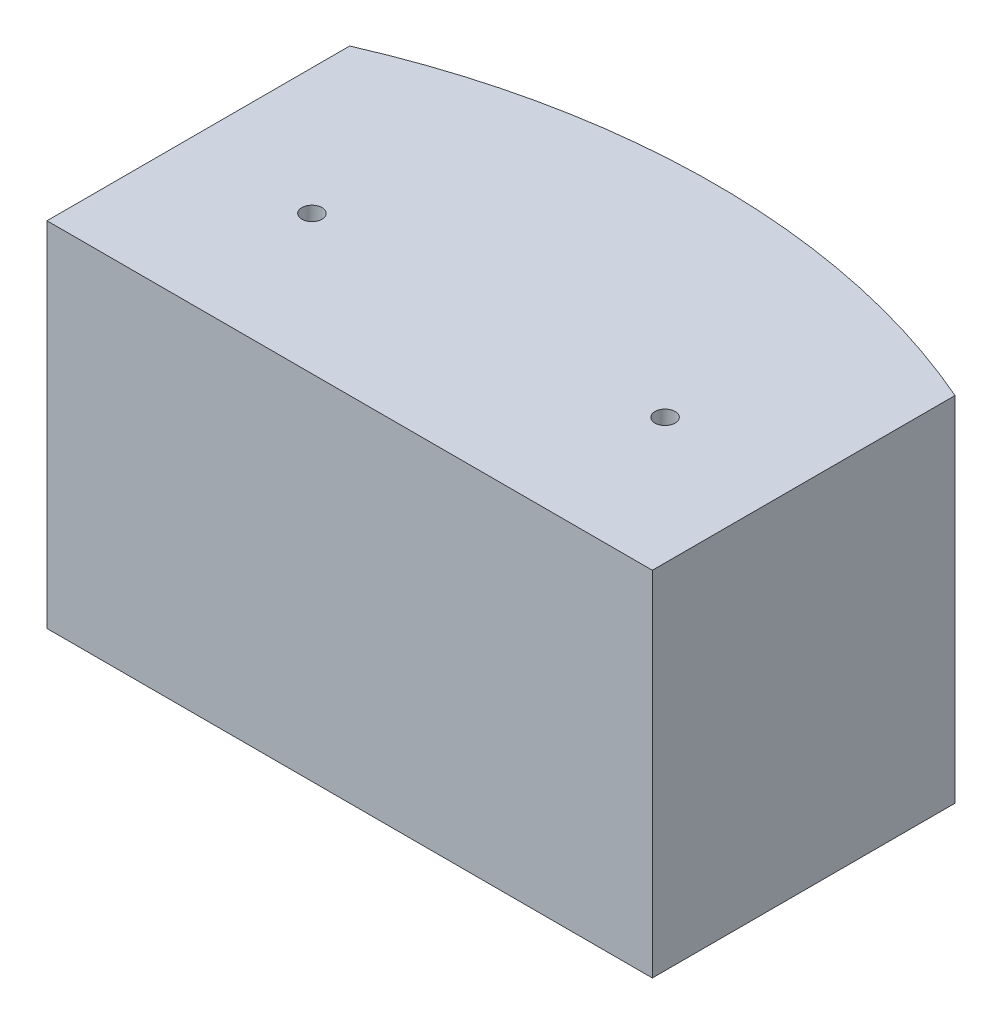
from build123d import *

# Parameters (mm, degrees)
BOSS_EXTRUDE1_DEPTH      = 70
SKETCH7_W                = 114
SKETCH7_H                = 64
CUT_EXTRUDE2_DEPTH       = 77
SKETCH8_W                = 3
SKETCH8_H                = 64
BOSS_EXTRUDE3_DEPTH      = 114
BOSS_EXTRUDE4_REACH      = 117.47
BOSS_EXTRUDE4_END_RADIUS = 150
SKETCH9_W                = 114
SKETCH9_H                = 3
SKETCH10_R               = 2
CUT_EXTRUDE3_DEPTH       = 3


with BuildPart() as part:
    # Sketch1 → Boss-Extrude1 (new body)
    with BuildSketch(Plane(origin=(0, 0, 0), x_dir=(1, 0, 0), z_dir=(0, 1, 0))):
        with BuildLine():
            Line((-60, 137.477270849), (-60, 77.477270849))
            Line((-60, 77.477270849), (60, 77.477270849))
            Line((60, 77.477270849), (60, 137.477270849))
            ThreePointArc((60, 137.477270849), (0, 150), (-60, 137.477270849))
        make_face()
    extrude(amount=BOSS_EXTRUDE1_DEPTH)

    # Sketch7 → Cut-Extrude2 (cut)
    with BuildSketch(Plane.XY.offset(-77.477270849)):
        with Locations((0, 35)):
            Rectangle(SKETCH7_W, SKETCH7_H)
    extrude(amount=-CUT_EXTRUDE2_DEPTH, mode=Mode.SUBTRACT)

    # Sketch8 → Boss-Extrude3 (add)
    with BuildSketch(Plane(origin=(-57, 0, 0), x_dir=(0, 0, -1), z_dir=(1, 0, 0))):
        with Locations((78.977270849, 35)):
            Rectangle(SKETCH8_W, SKETCH8_H)
    extrude(amount=BOSS_EXTRUDE3_DEPTH)

    # Boss-Extrude4: up to this cylinder (the profile starts inside it)
    boss_extrude4_end = Plane(origin=(0, 35, 0), z_dir=(0, -1, 0)) * Cylinder(BOSS_EXTRUDE4_END_RADIUS, 535.94, mode=Mode.PRIVATE)
    # Sketch9 → Boss-Extrude4 (add, up to the surface)
    with BuildSketch(Plane(origin=(0, 0, -80.477270849), x_dir=(-1, 0, 0), z_dir=(0, 0, -1)), mode=Mode.PRIVATE) as boss_extrude4_sk1:
        with Locations((0, 35)):
            Rectangle(SKETCH9_W, SKETCH9_H)
    boss_extrude4_tool1 = extrude(boss_extrude4_sk1.sketch, amount=BOSS_EXTRUDE4_REACH, mode=Mode.PRIVATE) & boss_extrude4_end
    add(boss_extrude4_tool1.solids().sort_by_distance((0, 35, -80.477271))[0])

    # Sketch10 → Cut-Extrude3 (cut)
    with BuildSketch(Plane(origin=(0, 70, 0), x_dir=(1, 0, 0), z_dir=(0, 1, 0))):
        with Locations(Location((-35, 104.997270849, 0), (0, 0, 270))):
            Circle(SKETCH10_R)
        with Locations(Location((35, 104.997270849, 0), (0, 0, 270))):
            Circle(SKETCH10_R)
    extrude(amount=-CUT_EXTRUDE3_DEPTH, mode=Mode.SUBTRACT)


solid = part.part
